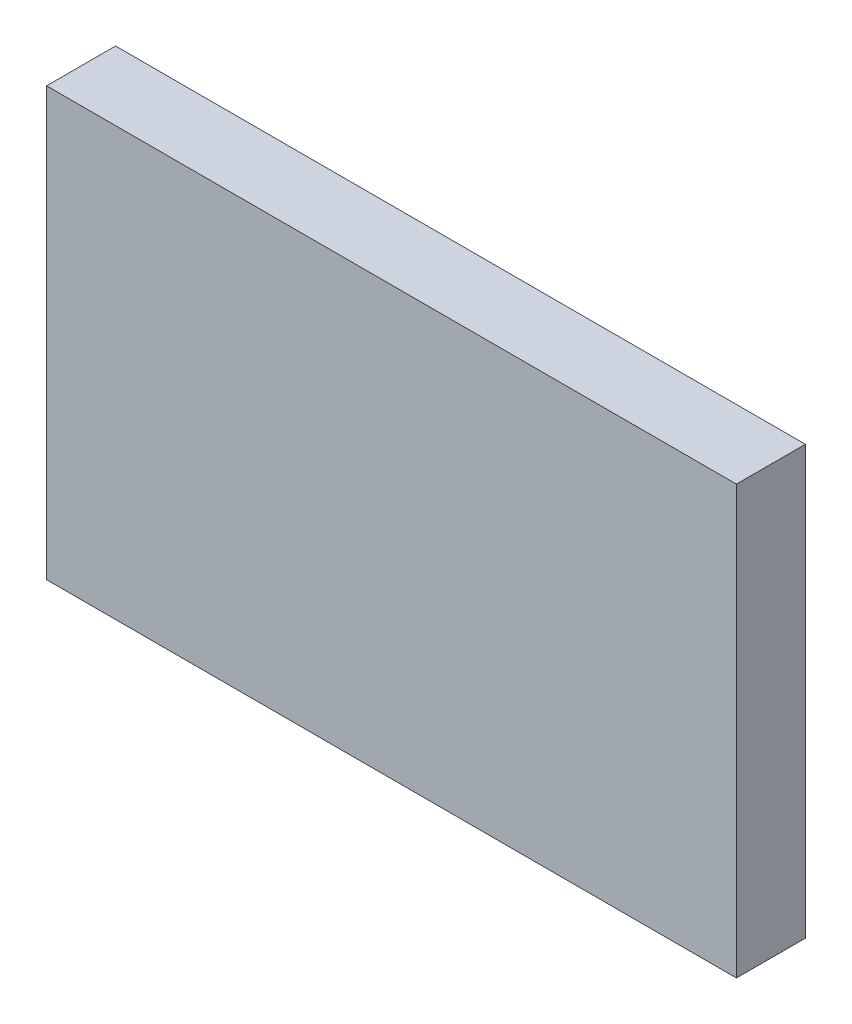
from build123d import *

# Parameters (mm, degrees)
SKETCH1_W           = 63.5
SKETCH1_H           = 39.37
BOSS_EXTRUDE1_DEPTH = 6.35


with BuildPart() as part:
    # Sketch1 → Boss-Extrude1 (new body)
    with BuildSketch(Plane.XY):
        with Locations((31.75, 19.685)):
            Rectangle(SKETCH1_W, SKETCH1_H)
    extrude(amount=-BOSS_EXTRUDE1_DEPTH)


solid = part.part
